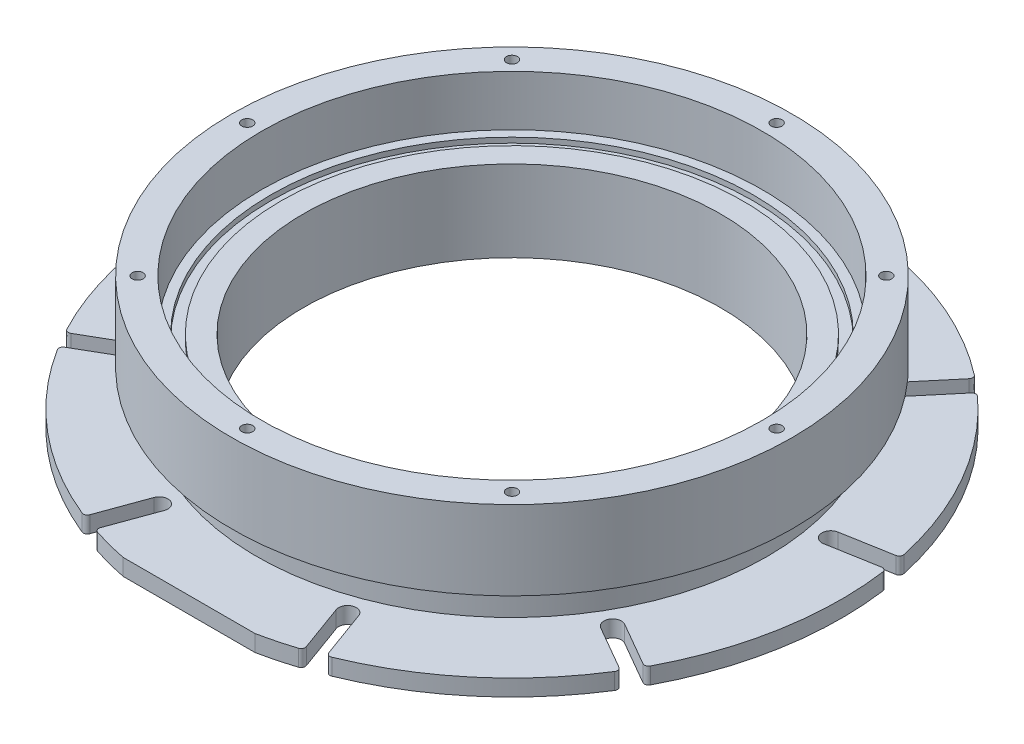
from build123d import *

# Parameters (mm, degrees)
M5X0_8_TAPPED_HOLE1_D     = 4.2
M5X0_8_TAPPED_HOLE1_DEPTH = 17.399
M5X0_8_TAPPED_HOLE1_TIP   = 1.2618073
CUT_EXTRUDE1_REACH        = 188.651
SKETCH7_W                 = 50.8
SKETCH7_H                 = 2.565921067
CUT_EXTRUDE2_REACH        = 188.651
FILLET1_R                 = 1.5875
CIRPATTERN1_COUNT         = 9
FILLET1_OF_CIRPATTERN1_R  = 1.5875
SKETCH11_R                = 93
SKETCH11_R_2              = 89
CUT_EXTRUDE3_DEPTH        = 2


with BuildPart() as part:
    # Sketch1 → Revolve1 (revolve)
    with BuildSketch(Plane.XY):
        Polygon((80.3783, 0), (127, 0), (127, 6.35), (98.425, 6.35), (98.425, 20.32), (108, 20.32), (108, 50.8), (96.5, 50.8), (96.5, 31.3), (80.3783, 31.3), align=None)
    revolve(axis=Axis((0, 0, 0), (0, 1, 0)))

    # M5x0.8 Tapped Hole1
    with Locations(Plane(origin=(0, 50.8, 0), x_dir=(1, 0, 0), z_dir=(0, 1, 0))):
        with Locations((0, 102), (72.124891681, 72.124891681), (102, 0), (72.124891681, -72.124891681), (0, -102), (-72.124891681, -72.124891681), (-102, 0), (-72.124891681, 72.124891681)):
            Hole(M5X0_8_TAPPED_HOLE1_D / 2, depth=M5X0_8_TAPPED_HOLE1_DEPTH)
            with Locations((0, 0, -(M5X0_8_TAPPED_HOLE1_DEPTH + M5X0_8_TAPPED_HOLE1_TIP / 2))):  # 118° drill point
                Cone(0, M5X0_8_TAPPED_HOLE1_D / 2, M5X0_8_TAPPED_HOLE1_TIP, mode=Mode.SUBTRACT)

    # Sketch7 → Cut-Extrude1 (cut, up to next)
    with BuildSketch(Plane(origin=(0, 50.8, 0), x_dir=(1, 0, 0), z_dir=(0, 1, 0)), mode=Mode.PRIVATE) as cut_extrude1_sk1:
        with Locations((0, -125.717039467)):
            Rectangle(SKETCH7_W, SKETCH7_H)
    cut_extrude1_tool1 = extrude(cut_extrude1_sk1.sketch, amount=-CUT_EXTRUDE1_REACH, mode=Mode.PRIVATE) & part.part
    add(cut_extrude1_tool1.solids().sort_by_distance((0, 50.8, 125.717039))[0], mode=Mode.SUBTRACT)

    # Sketch10 → Cut-Extrude2 (cut, up to next)
    with BuildSketch(Plane.XZ, mode=Mode.PRIVATE) as cut_extrude2_sk1:
        with BuildLine():
            Line((-3.3782, -106.045), (-3.3782, -127))
            Line((-3.3782, -127), (3.3782, -127))
            Line((3.3782, -127), (3.3782, -106.045))
            ThreePointArc((3.3782, -106.045), (0, -102.6668), (-3.3782, -106.045))
        make_face()
    cut_extrude2_tool1 = extrude(cut_extrude2_sk1.sketch, amount=-CUT_EXTRUDE2_REACH, mode=Mode.PRIVATE) & part.part
    cut_extrude2 = cut_extrude2_tool1.solids().sort_by_distance((0, 0, -115.183843))[0]
    add(cut_extrude2, mode=Mode.SUBTRACT)

    # Fillet1
    fillet1_edges = [part.edges().sort_by_distance(p)[0] for p in [
        (-3.3782, 3.175, -126.95506199),
        (3.3782, 3.175, -126.95506199),
    ]]
    fillet(fillet1_edges, radius=FILLET1_R)

    # CirPattern1: Cut-Extrude2 ×9 about axis
    cirpattern1_axis = Axis((0, 0, 0), (0, 1, 0))
    for i in range(1, CIRPATTERN1_COUNT):
        add(cut_extrude2.rotate(cirpattern1_axis, i * 360 / CIRPATTERN1_COUNT), mode=Mode.SUBTRACT)

    # Fillet1 of CirPattern1
    fillet1_of_cirpattern1_edges = [part.edges().sort_by_distance(p)[0] for p in [
        (-84.192992172, 3.175, -95.08175466),
        (-79.017289496, 3.175, -99.424684866),
        (-125.612947605, 3.175, -18.718637609),
        (-124.439711058, 3.175, -25.372392711),
        (-108.257208822, 3.175, 66.403138014),
        (-111.635408822, 3.175, 60.551923976),
        (-40.246718886, 3.175, 120.454147371),
        (-46.595658109, 3.175, 118.143322475),
        (46.595658109, 3.175, 118.143322475),
        (40.246718886, 3.175, 120.454147371),
        (111.635408822, 3.175, 60.551923976),
        (108.257208822, 3.175, 66.403138014),
        (124.439711058, 3.175, -25.372392711),
        (125.612947605, 3.175, -18.718637609),
        (79.017289496, 3.175, -99.424684866),
        (84.192992172, 3.175, -95.08175466),
    ]]
    fillet(fillet1_of_cirpattern1_edges, radius=FILLET1_OF_CIRPATTERN1_R)

    # Sketch11 → Cut-Extrude3 (cut)
    with BuildSketch(Plane(origin=(0, 31.3, 0), x_dir=(1, 0, 0), z_dir=(0, 1, 0))):
        with Locations(Location((0, 0, 0), (0, 0, 180))):
            Circle(SKETCH11_R)
        with Locations(Location((0, 0, 0), (0, 0, 180))):
            Circle(SKETCH11_R_2, mode=Mode.SUBTRACT)
    extrude(amount=-CUT_EXTRUDE3_DEPTH, mode=Mode.SUBTRACT)


solid = part.part
